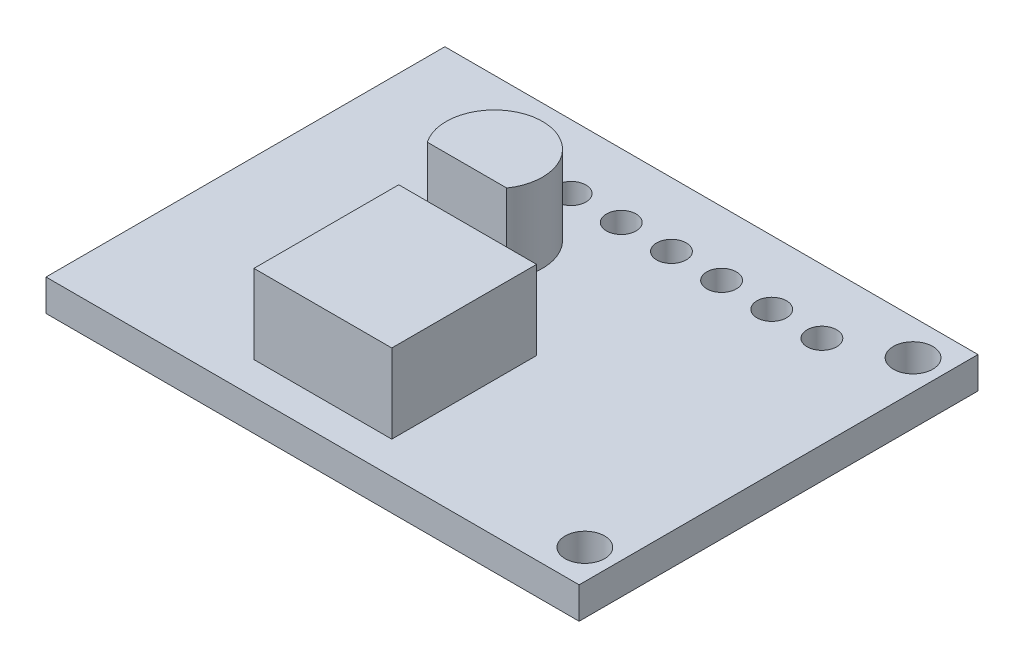
from build123d import *

# Parameters (mm, degrees)
SKETCH1_W           = 27
SKETCH1_H           = 20.2
BOSS_EXTRUDE1_DEPTH = 1.6
SKETCH2_R           = 1
CUT_EXTRUDE1_DEPTH  = 17.935760981
SKETCH4_R           = 0.75
CUT_EXTRUDE2_DEPTH  = 17.935760981
SKETCH6_W           = 6.981427811
SKETCH6_H           = 7.333205182
BOSS_EXTRUDE2_DEPTH = 4
BOSS_EXTRUDE3_DEPTH = 4


with BuildPart() as part:
    # Sketch1 → Boss-Extrude1 (new body)
    with BuildSketch(Plane(origin=(0, 0, 0), x_dir=(1, 0, 0), z_dir=(0, 1, 0))):
        Rectangle(SKETCH1_W, SKETCH1_H)
    extrude(amount=BOSS_EXTRUDE1_DEPTH)

    # Sketch2 → Cut-Extrude1 (cut, through all)
    with BuildSketch(Plane(origin=(0, 1.6, 0), x_dir=(1, 0, 0), z_dir=(0, 1, 0))):
        with Locations(Location((12, 8.310541443, 0), (0, 0, 270))):
            Circle(SKETCH2_R)
        with Locations(Location((12, -8.310541443, 0), (0, 0, 270))):
            Circle(SKETCH2_R)
    extrude(amount=-CUT_EXTRUDE1_DEPTH, mode=Mode.SUBTRACT)

    # Sketch4 → Cut-Extrude2 (cut, through all)
    with BuildSketch(Plane(origin=(0, 1.6, 0), x_dir=(1, 0, 0), z_dir=(0, 1, 0))):
        with Locations(Location((8.835023955, 6.859658721, 0), (0, 0, 270))):
            Circle(SKETCH4_R)
        with Locations(Location((6.295023955, 6.859658721, 0), (0, 0, 270))):
            Circle(SKETCH4_R)
        with Locations(Location((3.755023955, 6.859658721, 0), (0, 0, 270))):
            Circle(SKETCH4_R)
        with Locations(Location((1.215023955, 6.859658721, 0), (0, 0, 270))):
            Circle(SKETCH4_R)
        with Locations(Location((-1.324976045, 6.859658721, 0), (0, 0, 270))):
            Circle(SKETCH4_R)
        with Locations(Location((-3.864976045, 6.859658721, 0), (0, 0, 270))):
            Circle(SKETCH4_R)
    extrude(amount=-CUT_EXTRUDE2_DEPTH, mode=Mode.SUBTRACT)

    # Sketch6 → Boss-Extrude2 (add)
    with BuildSketch(Plane(origin=(0, 1.6, 0), x_dir=(1, 0, 0), z_dir=(0, 1, 0))):
        with Locations((-1.122981606, -4.789584196)):
            Rectangle(SKETCH6_W, SKETCH6_H)
    extrude(amount=BOSS_EXTRUDE2_DEPTH)

    # Sketch7 → Boss-Extrude3 (add)
    with BuildSketch(Plane(origin=(0, 1.6, 0), x_dir=(1, 0, 0), z_dir=(0, 1, 0))):
        with BuildLine():
            Line((-5.758618523, 1.468961855), (-1.736945444, 1.468961855))
            ThreePointArc((-1.736945444, 1.468961855), (-3.747781984, 5.296946033), (-5.758618523, 1.468961855))
        make_face()
    extrude(amount=BOSS_EXTRUDE3_DEPTH)


solid = part.part
